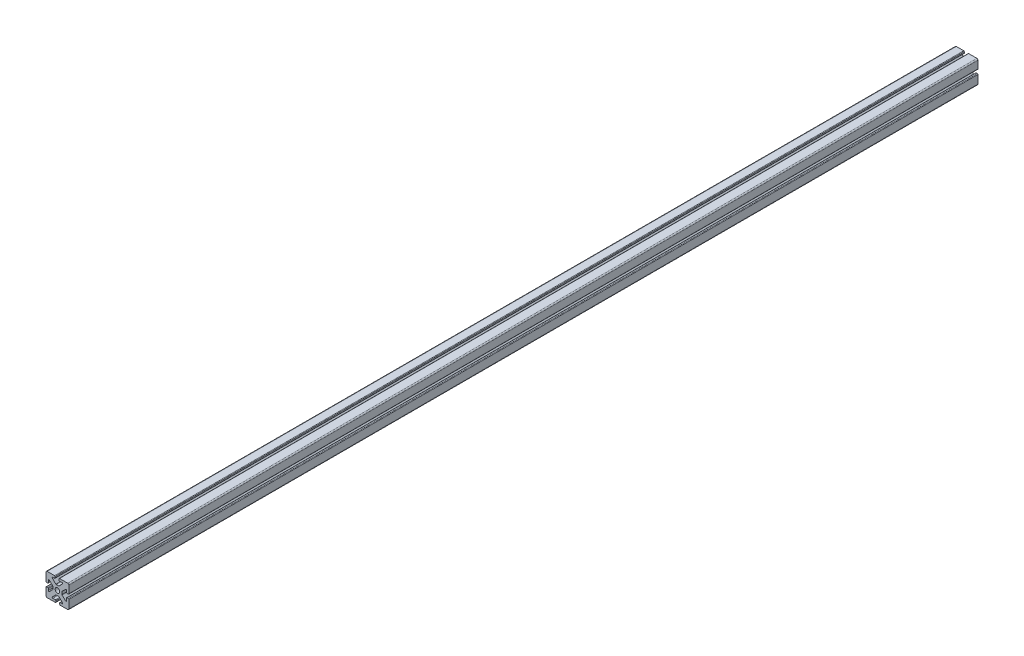
from build123d import *

# Parameters (mm, degrees)
SKETCH_1_W               = 40
SKETCH_1_H               = 40
EXTRUDE_1_DEPTH          = 1593
SKETCH_2_R               = 4.05
CUT_EXTRUDE_1_DEPTH      = 10000
CUT_EXTRUDE_2_DEPTH      = 10000
FILLET_1_R               = 1
PATTERN_CIRCULAR_2_COUNT = 4
FILLET_2_R               = 1
FILLET_3_R               = 1
FILLET_4_R               = 1
FILLET_5_R               = 2


with BuildPart() as part:
    # 草图1 → 凸台-拉伸1 (new body)
    with BuildSketch(Plane.XY):
        Rectangle(SKETCH_1_W, SKETCH_1_H)
    extrude(amount=EXTRUDE_1_DEPTH)

    # 草图2 → 切除-拉伸1 (cut)
    with BuildSketch(Plane.XY.offset(1593)):
        Circle(SKETCH_2_R)
    extrude(amount=-CUT_EXTRUDE_1_DEPTH, mode=Mode.SUBTRACT)

    # 草图4 → 切除-拉伸2 (cut)
    with BuildSketch(Plane.XY.offset(1593)):
        Polygon((20, 0), (20, 4), (16, 4), (16, 10.5), (7.876860985, 2.6), (7.876860985, -2.6), (16, -10.5), (16, -2.65197969), (20, -2.65197969), align=None)
    cut_extrude_2 = extrude(amount=-CUT_EXTRUDE_2_DEPTH, mode=Mode.SUBTRACT)

    # 圆角1
    fillet_1_edges = [part.edges().sort_by_distance(p)[0] for p in [
        (20, -2.65197969, 796.5),
        (16, -2.65197969, 796.5),
        (16, -10.5, 796.5),
        (7.876860985, -2.6, 796.5),
        (7.876860985, 2.6, 796.5),
        (16, 10.5, 796.5),
        (16, 4, 796.5),
        (20, 4, 796.5),
    ]]
    fillet(fillet_1_edges, radius=FILLET_1_R)

    # 阵列(圆周)2: 切除-拉伸2 ×4 about axis
    pattern_circular_2_axis = Axis((0, 0, 0), (0, 0, 1))
    for i in range(1, PATTERN_CIRCULAR_2_COUNT):
        add(cut_extrude_2.rotate(pattern_circular_2_axis, i * 360 / PATTERN_CIRCULAR_2_COUNT), mode=Mode.SUBTRACT)

    # 圆角2
    fillet_2_edges = [part.edges().sort_by_distance(p)[0] for p in [
        (2.65197969, 20, 796.5),
        (2.65197969, 16, 796.5),
        (10.5, 16, 796.5),
        (2.6, 7.876860985, 796.5),
        (-2.6, 7.876860985, 796.5),
        (-10.5, 16, 796.5),
        (-4, 16, 796.5),
        (-4, 20, 796.5),
    ]]
    fillet(fillet_2_edges, radius=FILLET_2_R)

    # 圆角3
    fillet_3_edges = [part.edges().sort_by_distance(p)[0] for p in [
        (-20, 2.65197969, 796.5),
        (-16, 2.65197969, 796.5),
        (-16, 10.5, 796.5),
        (-7.876860985, 2.6, 796.5),
        (-7.876860985, -2.6, 796.5),
        (-16, -10.5, 796.5),
        (-16, -4, 796.5),
        (-20, -4, 796.5),
    ]]
    fillet(fillet_3_edges, radius=FILLET_3_R)

    # 圆角4
    fillet_4_edges = [part.edges().sort_by_distance(p)[0] for p in [
        (-2.65197969, -20, 796.5),
        (-2.65197969, -16, 796.5),
        (-10.5, -16, 796.5),
        (-2.6, -7.876860985, 796.5),
        (2.6, -7.876860985, 796.5),
        (10.5, -16, 796.5),
        (4, -16, 796.5),
        (4, -20, 796.5),
    ]]
    fillet(fillet_4_edges, radius=FILLET_4_R)

    # 圆角5
    fillet_5_edges = [part.edges().sort_by_distance(p)[0] for p in [
        (20, -20, 796.5),
        (-20, -20, 796.5),
        (-20, 20, 796.5),
        (20, 20, 796.5),
    ]]
    fillet(fillet_5_edges, radius=FILLET_5_R)


solid = part.part
